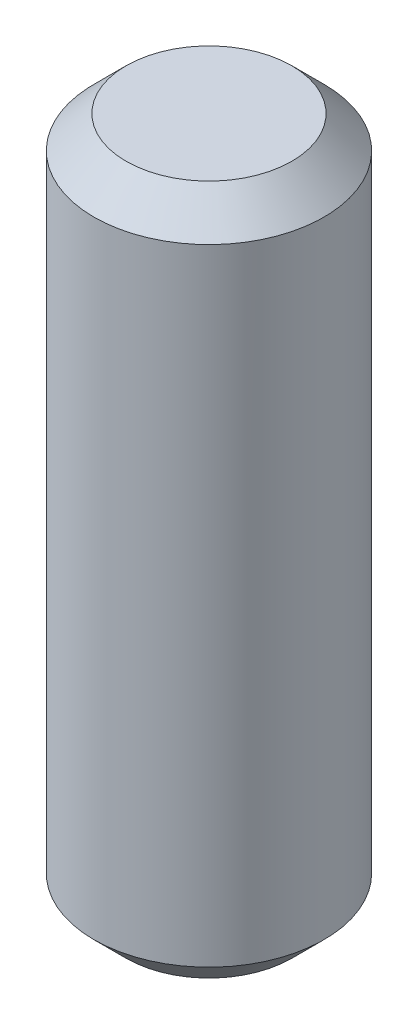
from build123d import *

# Parameters (mm, degrees)
SKETCH1_R           = 2.6
BOSS_EXTRUDE1_DEPTH = 15
CHAMFER1_SIZE       = 0.8
SKETCH2_R           = 2.6
SKETCH2_R_2         = 2.5
CUT_EXTRUDE2_DEPTH  = 16.444092722


with BuildPart() as part:
    # Sketch1 → Boss-Extrude1 (new body)
    with BuildSketch(Plane(origin=(0, 0, 0), x_dir=(1, 0, 0), z_dir=(0, 1, 0))):
        with Locations(Location((0, 0, 0), (0, 0, 270))):
            Circle(SKETCH1_R)
    extrude(amount=BOSS_EXTRUDE1_DEPTH)

    # Chamfer1
    chamfer1_edges = [part.edges().sort_by_distance(p)[0] for p in [
        (0, 0, -2.6),
        (0, 15, -2.6),
    ]]
    chamfer(chamfer1_edges, length=CHAMFER1_SIZE)

    # Sketch2 → Cut-Extrude2 (cut, through all)
    with BuildSketch(Plane(origin=(0, 15, 0), x_dir=(1, 0, 0), z_dir=(0, 1, 0))):
        Circle(SKETCH2_R)
        with Locations(Location((0, 0, 0), (0, 0, 270))):
            Circle(SKETCH2_R_2, mode=Mode.SUBTRACT)
    extrude(amount=-CUT_EXTRUDE2_DEPTH, mode=Mode.SUBTRACT)


solid = part.part
